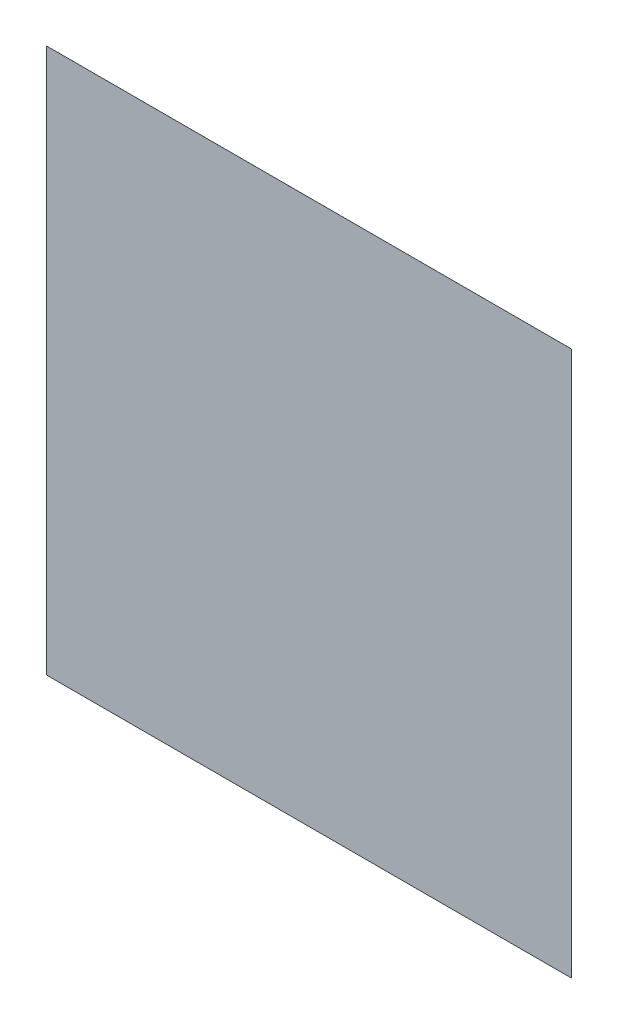
from build123d import *

# Parameters (mm, degrees)
SKETCH1_W           = 10.06699
SKETCH1_H           = 10.45539
BOSS_EXTRUDE1_DEPTH = 0.00025


with BuildPart() as part:
    # Sketch1 → Boss-Extrude1 (new body)
    with BuildSketch(Plane.XY):
        with Locations((-0.117285, 0.310895)):
            Rectangle(SKETCH1_W, SKETCH1_H)
    extrude(amount=BOSS_EXTRUDE1_DEPTH)


solid = part.part
